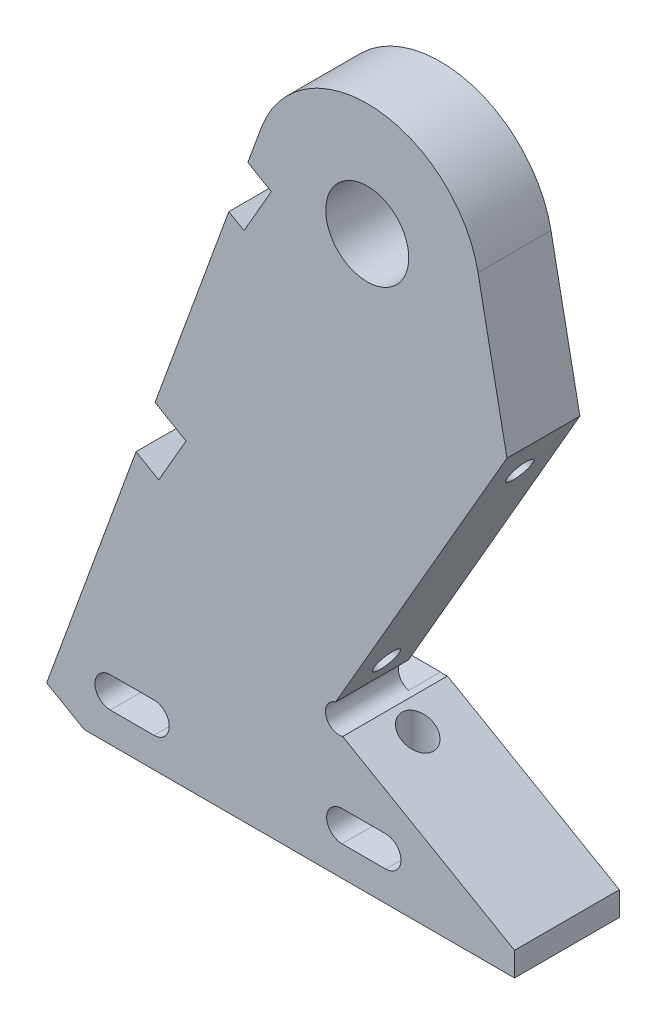
from build123d import *

# Parameters (mm, degrees)
MODEL_R                   = 3.175
BOSS_EXTRUDE1_DEPTH       = 8.4836
F_4_CLEARANCE_HOLE3_D     = 2.9464
F_4_CLEARANCE_HOLE4_D     = 2.9464
BOSS_EXTRUDE2_START       = 3.7084
BOSS_EXTRUDE2_DEPTH       = 3.7084
CUT_EXTRUDE1_DEPTH        = 60.573404892
F_6_CLEARANCE_HOLE2_D     = 3.6576
F_6_CLEARANCE_HOLE2_DEPTH = 14.3256
F_6_CLEARANCE_HOLE2_TIP   = 1.0988539
SKETCH20_R                = 4.826
CUT_EXTRUDE2_DEPTH        = 60.573404892


with BuildPart() as part:
    # Model → Boss-Extrude1 (new body)
    with BuildSketch(Plane.XY):
        with BuildLine():
            Line((30.032015577, -29.521189504), (30.032015577, -26.729824585))
            Line((30.032015577, -26.729824585), (10.04882977, -15.19252688))
            ThreePointArc((10.04882977, -15.19252688), (8.104547287, -14.069994865), (9.227079302, -12.125712382))
            Line((9.227079302, -12.125712382), (29.151876156, 22.3850481))
            Line((29.151876156, 22.3850481), (25.790540116, 39.397524407))
            ThreePointArc((25.790540116, 39.397524407), (13.922877184, 49.944916766), (0.570865514, 41.353485372))
            Line((0.570865514, 41.353485372), (-0.979565285, 37.104375313))
            Line((-0.979565285, 37.104375313), (1.753621818, 35.526369004))
            Line((1.753621818, 35.526369004), (-1.421378182, 30.02710769))
            Line((-1.421378182, 30.02710769), (-3.189468587, 31.047915161))
            Line((-3.189468587, 31.047915161), (-11.768069595, 7.537404491))
            Line((-11.768069595, 7.537404491), (-8.165923931, 5.457704722))
            Line((-8.165923931, 5.457704722), (-11.34077003, -0.041645446))
            Line((-11.34077003, -0.041645446), (-13.977972897, 1.480944339))
            Line((-13.977972897, 1.480944339), (-24.373743148, -27.00969967))
            Line((-24.373743148, -27.00969967), (-20.022585807, -29.521189504))
            Line((-20.022585807, -29.521189504), (30.032015577, -29.521189504))
        make_face()
        with Locations(Location((12.90743615, 36.852072417, 0), (0, 0, 180))):
            Circle(MODEL_R, mode=Mode.SUBTRACT)
    extrude(amount=BOSS_EXTRUDE1_DEPTH)

    # #4 Clearance Hole3 (through all)
    with Locations(Plane(origin=(-14.068152667, 8.12225173, 0), x_dir=(0, 0, 1), z_dir=(-0.8660254037844389, 0.4999999999999996, 0))):
        with Locations((4.2418, 28.46854897)):
            Hole(F_4_CLEARANCE_HOLE3_D / 2)

    # #4 Clearance Hole4 (through all)
    with Locations(Plane(origin=(-8.487819953, 4.900128422, 0), x_dir=(0, 0, 1), z_dir=(-0.8660393963332388, 0.49997576341134725, 0))):
        with Locations((4.2418, -2.53117675)):
            Hole(F_4_CLEARANCE_HOLE4_D / 2)

    # Sketch12 → Boss-Extrude2 (add)
    with BuildSketch(Plane(origin=(0, 0, 0), x_dir=(-1, 0, 0), z_dir=(0, 0, -1)).offset(BOSS_EXTRUDE2_START)):
        with BuildLine():
            Line((20.062967478, -15.195589504), (-9.238684477, -15.195589504))
            ThreePointArc((-9.238684477, -15.195589504), (-9.643955781, -15.246608288), (-10.04882977, -15.19252688))
            Line((-10.04882977, -15.19252688), (-30.032015577, -26.729824585))
            Line((-30.032015577, -26.729824585), (-30.032015577, -29.521189504))
            Line((-30.032015577, -29.521189504), (20.022585807, -29.521189504))
            Line((20.022585807, -29.521189504), (24.373743148, -27.00969967))
            Line((24.373743148, -27.00969967), (20.062967478, -15.195589504))
        make_face()
    extrude(amount=-BOSS_EXTRUDE2_DEPTH)

    # Sketch14 → Cut-Extrude1 (cut, through all)
    with BuildSketch(Plane.XY.offset(8.4836)):
        with BuildLine():
            Line((-16.974585807, -22.485389504), (-11.894585807, -22.485389504))
            ThreePointArc((-11.894585807, -22.485389504), (-10.116585807, -24.263389504), (-11.894585807, -26.041389504))
            Line((-11.894585807, -26.041389504), (-16.974585807, -26.041389504))
            ThreePointArc((-16.974585807, -26.041389504), (-18.752585807, -24.263389504), (-16.974585807, -22.485389504))
        make_face()
        with BuildLine():
            Line((9.966182511, -22.485389504), (15.046182511, -22.485389504))
            ThreePointArc((15.046182511, -22.485389504), (16.824182511, -24.263389504), (15.046182511, -26.041389504))
            Line((15.046182511, -26.041389504), (9.966182511, -26.041389504))
            ThreePointArc((9.966182511, -26.041389504), (8.188182511, -24.263389504), (9.966182511, -22.485389504))
        make_face()
    extrude(amount=-CUT_EXTRUDE1_DEPTH, mode=Mode.SUBTRACT)

    # #6 Clearance Hole2
    with Locations(Plane(origin=(0, -29.521189504, 0), x_dir=(-1, 0, 0), z_dir=(0, -1, 0))):
        with Locations((14.433829056, -2.212184194), (-12.506939307, -2.212184194)):
            Hole(F_6_CLEARANCE_HOLE2_D / 2, depth=F_6_CLEARANCE_HOLE2_DEPTH)
            with Locations((0, 0, -(F_6_CLEARANCE_HOLE2_DEPTH + F_6_CLEARANCE_HOLE2_TIP / 2))):  # 118° drill point
                Cone(0, F_6_CLEARANCE_HOLE2_D / 2, F_6_CLEARANCE_HOLE2_TIP, mode=Mode.SUBTRACT)

    # Sketch20 → Cut-Extrude2 (cut, through all)
    with BuildSketch(Plane.XY.offset(8.4836)):
        with Locations((12.90743615, 36.852072417)):
            Circle(SKETCH20_R)
    extrude(amount=-CUT_EXTRUDE2_DEPTH, mode=Mode.SUBTRACT)


solid = part.part
